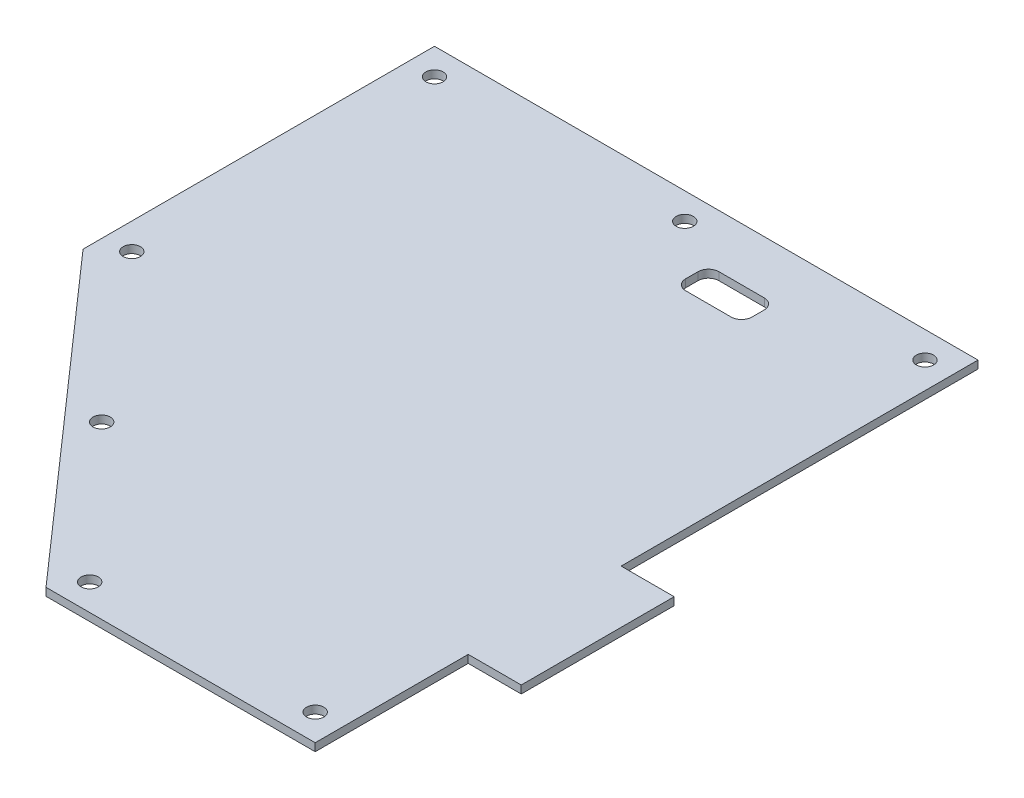
from build123d import *

# Parameters (mm, degrees)
BOSS_EXTRUDE1_DEPTH   = 1.5
F_4_0MM_DOWEL_HOLE1_D = 3.3
SKETCH4_W             = 12.7
SKETCH4_H             = 6.35
CUT_EXTRUDE1_DEPTH    = 1.5
FILLET1_R             = 2


with BuildPart() as part:
    # Sketch1 → Boss-Extrude1 (new body)
    with BuildSketch(Plane(origin=(0, 0, 0), x_dir=(1, 0, 0), z_dir=(0, 1, 0))):
        Polygon((0, 0), (104.14, 0), (104.140084457, -68.379681711), (114.300084457, -68.379681711), (114.300084457, -97.679681711), (104.140084457, -97.679681711), (104.140084457, -126.999681711), (52.560084457, -126.999681711), (0, -67.34), align=None)
    extrude(amount=BOSS_EXTRUDE1_DEPTH)

    # Ø4.0mm Dowel Hole1 (through all)
    with Locations(Plane(origin=(5.08, 1.5, 5.08), x_dir=(0, 0, 1), z_dir=(0, 1, 0))):
        with Locations((0, 0), (0, 47.95), (0, 93.980006274), (116.839681711, 93.980084457), (116.839681711, 50.770084457), (89.156056724, 25.385630403), (58, 0)):
            Hole(F_4_0MM_DOWEL_HOLE1_D / 2)

    # Sketch4 → Cut-Extrude1 (cut)
    with BuildSketch(Plane(origin=(0, 1.5, 0), x_dir=(1, 0, 0), z_dir=(0, 1, 0))):
        with Locations((69, -13.335)):
            Rectangle(SKETCH4_W, SKETCH4_H)
    extrude(amount=-CUT_EXTRUDE1_DEPTH, mode=Mode.SUBTRACT)

    # Fillet1
    fillet1_edges = [part.edges().sort_by_distance(p)[0] for p in [
        (62.65, 0.75, 10.16),
        (62.65, 0.75, 16.51),
        (75.35, 0.75, 16.51),
        (75.35, 0.75, 10.16),
    ]]
    fillet(fillet1_edges, radius=FILLET1_R)


solid = part.part
